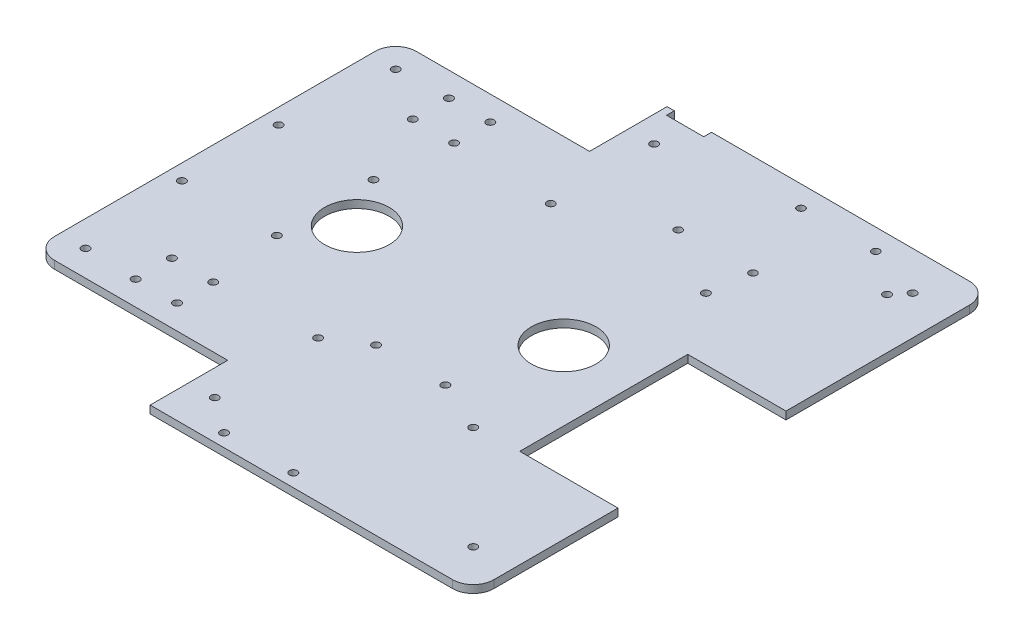
from build123d import *

# Parameters (mm, degrees)
SKETCH1_W                      = 200
SKETCH1_H                      = 200
BOSS_EXTRUDE1_DEPTH            = 3
CUT_EXTRUDE4_REACH             = 143.453
SKETCH4_R                      = 1.5
CUT_EXTRUDE5_REACH             = 143.453
SKETCH5_W                      = 75
SKETCH5_H                      = 30
CUT_EXTRUDE5_DIRECTION_2_DEPTH = 142.453172464
CUT_EXTRUDE6_REACH             = 143.453
SKETCH3_R                      = 1.5
FILLET1_R                      = 8
CUT_EXTRUDE7_REACH             = 143.453
SKETCH6_R                      = 1.5
CUT_EXTRUDE9_REACH             = 143.453
SKETCH11_W                     = 38
SKETCH11_H                     = 65
CUT_EXTRUDE10_REACH            = 143.453
SKETCH12_R                     = 12.5
CUT_EXTRUDE11_REACH            = 143.453
SKETCH14_R                     = 1.5
CUT_EXTRUDE12_REACH            = 143.453
SKETCH15_R                     = 1.5
CUT_EXTRUDE14_REACH            = 143.453
SKETCH17_R                     = 1.4605
CUT_EXTRUDE15_REACH            = 143.453
SKETCH18_R                     = 1.5
CUT_EXTRUDE17_REACH            = 143.453
SKETCH19_W                     = 14.4
SKETCH19_H                     = 3


with BuildPart() as part:
    # Sketch1 → Boss-Extrude1 (new body)
    with BuildSketch(Plane(origin=(0, 0, 0), x_dir=(1, 0, 0), z_dir=(0, 1, 0))):
        Rectangle(SKETCH1_W, SKETCH1_H)
    extrude(amount=BOSS_EXTRUDE1_DEPTH)

    # Sketch4 → Cut-Extrude4 (cut, up to next)
    with BuildSketch(Plane.XZ, mode=Mode.PRIVATE) as cut_extrude4_sk1:
        with Locations(Location((-15, 45, 0), (0, 0, 270))):
            Circle(SKETCH4_R)
    cut_extrude4_tool1 = extrude(cut_extrude4_sk1.sketch, amount=-CUT_EXTRUDE4_REACH, mode=Mode.PRIVATE) & part.part
    # Sketch4 → Cut-Extrude4 (cut, up to next)
    with BuildSketch(Plane.XZ, mode=Mode.PRIVATE) as cut_extrude4_sk2:
        with Locations(Location((45, 45, 0), (0, 0, 270))):
            Circle(SKETCH4_R)
    cut_extrude4_tool2 = extrude(cut_extrude4_sk2.sketch, amount=-CUT_EXTRUDE4_REACH, mode=Mode.PRIVATE) & part.part
    # Sketch4 → Cut-Extrude4 (cut, up to next)
    with BuildSketch(Plane.XZ, mode=Mode.PRIVATE) as cut_extrude4_sk3:
        with Locations(Location((45, -45, 0), (0, 0, 270))):
            Circle(SKETCH4_R)
    cut_extrude4_tool3 = extrude(cut_extrude4_sk3.sketch, amount=-CUT_EXTRUDE4_REACH, mode=Mode.PRIVATE) & part.part
    # Sketch4 → Cut-Extrude4 (cut, up to next)
    with BuildSketch(Plane.XZ, mode=Mode.PRIVATE) as cut_extrude4_sk4:
        with Locations(Location((-15, -45, 0), (0, 0, 270))):
            Circle(SKETCH4_R)
    cut_extrude4_tool4 = extrude(cut_extrude4_sk4.sketch, amount=-CUT_EXTRUDE4_REACH, mode=Mode.PRIVATE) & part.part
    add(cut_extrude4_tool1.solids().sort_by_distance((-15, 0, 45))[0], mode=Mode.SUBTRACT)
    add(cut_extrude4_tool2.solids().sort_by_distance((45, 0, 45))[0], mode=Mode.SUBTRACT)
    add(cut_extrude4_tool3.solids().sort_by_distance((45, 0, -45))[0], mode=Mode.SUBTRACT)
    add(cut_extrude4_tool4.solids().sort_by_distance((-15, 0, -45))[0], mode=Mode.SUBTRACT)

    # Sketch5 → Cut-Extrude5 (cut, up to next)
    with BuildSketch(Plane.XZ, mode=Mode.PRIVATE) as cut_extrude5_sk1:
        with Locations((-62.5, -85)):
            Rectangle(SKETCH5_W, SKETCH5_H)
    cut_extrude5_tool1 = extrude(cut_extrude5_sk1.sketch, amount=-CUT_EXTRUDE5_REACH, mode=Mode.PRIVATE) & part.part
    # Sketch5 → Cut-Extrude5 (cut, up to next)
    with BuildSketch(Plane.XZ, mode=Mode.PRIVATE) as cut_extrude5_sk2:
        with Locations((-62.5, 85)):
            Rectangle(SKETCH5_W, SKETCH5_H)
    cut_extrude5_tool2 = extrude(cut_extrude5_sk2.sketch, amount=-CUT_EXTRUDE5_REACH, mode=Mode.PRIVATE) & part.part
    add(cut_extrude5_tool1.solids().sort_by_distance((-62.5, 0, -85))[0], mode=Mode.SUBTRACT)
    add(cut_extrude5_tool2.solids().sort_by_distance((-62.5, 0, 85))[0], mode=Mode.SUBTRACT)

    # Sketch5 → Cut-Extrude5 direction 2 (cut)
    with BuildSketch(Plane.XZ):
        with Locations((-62.5, -85)):
            Rectangle(SKETCH5_W, SKETCH5_H)
        with Locations((-62.5, 85)):
            Rectangle(SKETCH5_W, SKETCH5_H)
    extrude(amount=CUT_EXTRUDE5_DIRECTION_2_DEPTH, mode=Mode.SUBTRACT)

    # Sketch3 → Cut-Extrude6 (cut, up to next)
    with BuildSketch(Plane.XZ, mode=Mode.PRIVATE) as cut_extrude6_sk1:
        with Locations(Location((-70, -60.6, 0), (0, 0, 270))):
            Circle(SKETCH3_R)
    cut_extrude6_tool1 = extrude(cut_extrude6_sk1.sketch, amount=-CUT_EXTRUDE6_REACH, mode=Mode.PRIVATE) & part.part
    # Sketch3 → Cut-Extrude6 (cut, up to next)
    with BuildSketch(Plane.XZ, mode=Mode.PRIVATE) as cut_extrude6_sk2:
        with Locations(Location((-70, -46.6, 0), (0, 0, 270))):
            Circle(SKETCH3_R)
    cut_extrude6_tool2 = extrude(cut_extrude6_sk2.sketch, amount=-CUT_EXTRUDE6_REACH, mode=Mode.PRIVATE) & part.part
    # Sketch3 → Cut-Extrude6 (cut, up to next)
    with BuildSketch(Plane.XZ, mode=Mode.PRIVATE) as cut_extrude6_sk3:
        with Locations(Location((-54, -46.6, 0), (0, 0, 270))):
            Circle(SKETCH3_R)
    cut_extrude6_tool3 = extrude(cut_extrude6_sk3.sketch, amount=-CUT_EXTRUDE6_REACH, mode=Mode.PRIVATE) & part.part
    # Sketch3 → Cut-Extrude6 (cut, up to next)
    with BuildSketch(Plane.XZ, mode=Mode.PRIVATE) as cut_extrude6_sk4:
        with Locations(Location((-54, -60.6, 0), (0, 0, 270))):
            Circle(SKETCH3_R)
    cut_extrude6_tool4 = extrude(cut_extrude6_sk4.sketch, amount=-CUT_EXTRUDE6_REACH, mode=Mode.PRIVATE) & part.part
    # Sketch3 → Cut-Extrude6 (cut, up to next)
    with BuildSketch(Plane.XZ, mode=Mode.PRIVATE) as cut_extrude6_sk5:
        with Locations(Location((-70, 60.6, 0), (0, 0, 270))):
            Circle(SKETCH3_R)
    cut_extrude6_tool5 = extrude(cut_extrude6_sk5.sketch, amount=-CUT_EXTRUDE6_REACH, mode=Mode.PRIVATE) & part.part
    # Sketch3 → Cut-Extrude6 (cut, up to next)
    with BuildSketch(Plane.XZ, mode=Mode.PRIVATE) as cut_extrude6_sk6:
        with Locations(Location((-54, 60.6, 0), (0, 0, 270))):
            Circle(SKETCH3_R)
    cut_extrude6_tool6 = extrude(cut_extrude6_sk6.sketch, amount=-CUT_EXTRUDE6_REACH, mode=Mode.PRIVATE) & part.part
    # Sketch3 → Cut-Extrude6 (cut, up to next)
    with BuildSketch(Plane.XZ, mode=Mode.PRIVATE) as cut_extrude6_sk7:
        with Locations(Location((-70, 46.6, 0), (0, 0, 270))):
            Circle(SKETCH3_R)
    cut_extrude6_tool7 = extrude(cut_extrude6_sk7.sketch, amount=-CUT_EXTRUDE6_REACH, mode=Mode.PRIVATE) & part.part
    # Sketch3 → Cut-Extrude6 (cut, up to next)
    with BuildSketch(Plane.XZ, mode=Mode.PRIVATE) as cut_extrude6_sk8:
        with Locations(Location((-54, 46.6, 0), (0, 0, 270))):
            Circle(SKETCH3_R)
    cut_extrude6_tool8 = extrude(cut_extrude6_sk8.sketch, amount=-CUT_EXTRUDE6_REACH, mode=Mode.PRIVATE) & part.part
    add(cut_extrude6_tool1.solids().sort_by_distance((-70, 0, -60.6))[0], mode=Mode.SUBTRACT)
    add(cut_extrude6_tool2.solids().sort_by_distance((-70, 0, -46.6))[0], mode=Mode.SUBTRACT)
    add(cut_extrude6_tool3.solids().sort_by_distance((-54, 0, -46.6))[0], mode=Mode.SUBTRACT)
    add(cut_extrude6_tool4.solids().sort_by_distance((-54, 0, -60.6))[0], mode=Mode.SUBTRACT)
    add(cut_extrude6_tool5.solids().sort_by_distance((-70, 0, 60.6))[0], mode=Mode.SUBTRACT)
    add(cut_extrude6_tool6.solids().sort_by_distance((-54, 0, 60.6))[0], mode=Mode.SUBTRACT)
    add(cut_extrude6_tool7.solids().sort_by_distance((-70, 0, 46.6))[0], mode=Mode.SUBTRACT)
    add(cut_extrude6_tool8.solids().sort_by_distance((-54, 0, 46.6))[0], mode=Mode.SUBTRACT)

    # Fillet1
    fillet1_edges = [part.edges().sort_by_distance(p)[0] for p in [
        (-100, 1.5, -70),
        (-100, 1.5, 70),
        (100, 1.5, 100),
        (100, 1.5, -100),
    ]]
    fillet(fillet1_edges, radius=FILLET1_R)

    # Sketch6 → Cut-Extrude7 (cut, up to next)
    with BuildSketch(Plane.XZ, mode=Mode.PRIVATE) as cut_extrude7_sk1:
        with Locations(Location((-90, 60, 0), (0, 0, 270))):
            Circle(SKETCH6_R)
    cut_extrude7_tool1 = extrude(cut_extrude7_sk1.sketch, amount=-CUT_EXTRUDE7_REACH, mode=Mode.PRIVATE) & part.part
    # Sketch6 → Cut-Extrude7 (cut, up to next)
    with BuildSketch(Plane.XZ, mode=Mode.PRIVATE) as cut_extrude7_sk2:
        with Locations(Location((-90, -60, 0), (0, 0, 270))):
            Circle(SKETCH6_R)
    cut_extrude7_tool2 = extrude(cut_extrude7_sk2.sketch, amount=-CUT_EXTRUDE7_REACH, mode=Mode.PRIVATE) & part.part
    # Sketch6 → Cut-Extrude7 (cut, up to next)
    with BuildSketch(Plane.XZ, mode=Mode.PRIVATE) as cut_extrude7_sk3:
        with Locations(Location((-15, -85, 0), (0, 0, 270))):
            Circle(SKETCH6_R)
    cut_extrude7_tool3 = extrude(cut_extrude7_sk3.sketch, amount=-CUT_EXTRUDE7_REACH, mode=Mode.PRIVATE) & part.part
    # Sketch6 → Cut-Extrude7 (cut, up to next)
    with BuildSketch(Plane.XZ, mode=Mode.PRIVATE) as cut_extrude7_sk4:
        with Locations(Location((85, -85, 0), (0, 0, 270))):
            Circle(SKETCH6_R)
    cut_extrude7_tool4 = extrude(cut_extrude7_sk4.sketch, amount=-CUT_EXTRUDE7_REACH, mode=Mode.PRIVATE) & part.part
    # Sketch6 → Cut-Extrude7 (cut, up to next)
    with BuildSketch(Plane.XZ, mode=Mode.PRIVATE) as cut_extrude7_sk5:
        with Locations(Location((85, 85, 0), (0, 0, 270))):
            Circle(SKETCH6_R)
    cut_extrude7_tool5 = extrude(cut_extrude7_sk5.sketch, amount=-CUT_EXTRUDE7_REACH, mode=Mode.PRIVATE) & part.part
    # Sketch6 → Cut-Extrude7 (cut, up to next)
    with BuildSketch(Plane.XZ, mode=Mode.PRIVATE) as cut_extrude7_sk6:
        with Locations(Location((-15, 85, 0), (0, 0, 270))):
            Circle(SKETCH6_R)
    cut_extrude7_tool6 = extrude(cut_extrude7_sk6.sketch, amount=-CUT_EXTRUDE7_REACH, mode=Mode.PRIVATE) & part.part
    add(cut_extrude7_tool1.solids().sort_by_distance((-90, 0, 60))[0], mode=Mode.SUBTRACT)
    add(cut_extrude7_tool2.solids().sort_by_distance((-90, 0, -60))[0], mode=Mode.SUBTRACT)
    add(cut_extrude7_tool3.solids().sort_by_distance((-15, 0, -85))[0], mode=Mode.SUBTRACT)
    add(cut_extrude7_tool4.solids().sort_by_distance((85, 0, -85))[0], mode=Mode.SUBTRACT)
    add(cut_extrude7_tool5.solids().sort_by_distance((85, 0, 85))[0], mode=Mode.SUBTRACT)
    add(cut_extrude7_tool6.solids().sort_by_distance((-15, 0, 85))[0], mode=Mode.SUBTRACT)

    # Sketch11 → Cut-Extrude9 (cut, up to next)
    with BuildSketch(Plane(origin=(0, 0, 0), x_dir=(1, 0, 0), z_dir=(0, 1, 0)), mode=Mode.PRIVATE) as cut_extrude9_sk1:
        with Locations((81, -11.5)):
            Rectangle(SKETCH11_W, SKETCH11_H)
    cut_extrude9_tool1 = extrude(cut_extrude9_sk1.sketch, amount=CUT_EXTRUDE9_REACH, mode=Mode.PRIVATE) & part.part
    add(cut_extrude9_tool1.solids().sort_by_distance((81, 0, 11.5))[0], mode=Mode.SUBTRACT)

    # Sketch12 → Cut-Extrude10 (cut, up to next)
    with BuildSketch(Plane(origin=(0, 0, 0), x_dir=(-1, 0, 0), z_dir=(0, -1, 0)), mode=Mode.PRIVATE) as cut_extrude10_sk1:
        with Locations(Location((-35, 0, 0), (0, 0, 90))):
            Circle(SKETCH12_R)
    cut_extrude10_tool1 = extrude(cut_extrude10_sk1.sketch, amount=-CUT_EXTRUDE10_REACH, mode=Mode.PRIVATE) & part.part
    # Sketch12 → Cut-Extrude10 (cut, up to next)
    with BuildSketch(Plane(origin=(0, 0, 0), x_dir=(-1, 0, 0), z_dir=(0, -1, 0)), mode=Mode.PRIVATE) as cut_extrude10_sk2:
        with Locations(Location((45, 0, 0), (0, 0, 90))):
            Circle(SKETCH12_R)
    cut_extrude10_tool2 = extrude(cut_extrude10_sk2.sketch, amount=-CUT_EXTRUDE10_REACH, mode=Mode.PRIVATE) & part.part
    add(cut_extrude10_tool1.solids().sort_by_distance((35, 0, 0))[0], mode=Mode.SUBTRACT)
    add(cut_extrude10_tool2.solids().sort_by_distance((-45, 0, 0))[0], mode=Mode.SUBTRACT)

    # Sketch14 → Cut-Extrude11 (cut, up to next)
    with BuildSketch(Plane(origin=(0, 0, 0), x_dir=(-1, 0, 0), z_dir=(0, -1, 0)), mode=Mode.PRIVATE) as cut_extrude11_sk1:
        with Locations(Location((94, 18.7, 0), (0, 0, 90))):
            Circle(SKETCH14_R)
    cut_extrude11_tool1 = extrude(cut_extrude11_sk1.sketch, amount=-CUT_EXTRUDE11_REACH, mode=Mode.PRIVATE) & part.part
    # Sketch14 → Cut-Extrude11 (cut, up to next)
    with BuildSketch(Plane(origin=(0, 0, 0), x_dir=(-1, 0, 0), z_dir=(0, -1, 0)), mode=Mode.PRIVATE) as cut_extrude11_sk2:
        with Locations(Location((94, -18.7, 0), (0, 0, 90))):
            Circle(SKETCH14_R)
    cut_extrude11_tool2 = extrude(cut_extrude11_sk2.sketch, amount=-CUT_EXTRUDE11_REACH, mode=Mode.PRIVATE) & part.part
    # Sketch14 → Cut-Extrude11 (cut, up to next)
    with BuildSketch(Plane(origin=(0, 0, 0), x_dir=(-1, 0, 0), z_dir=(0, -1, 0)), mode=Mode.PRIVATE) as cut_extrude11_sk3:
        with Locations(Location((57.3, -18.7, 0), (0, 0, 90))):
            Circle(SKETCH14_R)
    cut_extrude11_tool3 = extrude(cut_extrude11_sk3.sketch, amount=-CUT_EXTRUDE11_REACH, mode=Mode.PRIVATE) & part.part
    # Sketch14 → Cut-Extrude11 (cut, up to next)
    with BuildSketch(Plane(origin=(0, 0, 0), x_dir=(-1, 0, 0), z_dir=(0, -1, 0)), mode=Mode.PRIVATE) as cut_extrude11_sk4:
        with Locations(Location((57.3, 18.7, 0), (0, 0, 90))):
            Circle(SKETCH14_R)
    cut_extrude11_tool4 = extrude(cut_extrude11_sk4.sketch, amount=-CUT_EXTRUDE11_REACH, mode=Mode.PRIVATE) & part.part
    add(cut_extrude11_tool1.solids().sort_by_distance((-94, 0, -18.7))[0], mode=Mode.SUBTRACT)
    add(cut_extrude11_tool2.solids().sort_by_distance((-94, 0, 18.7))[0], mode=Mode.SUBTRACT)
    add(cut_extrude11_tool3.solids().sort_by_distance((-57.3, 0, 18.7))[0], mode=Mode.SUBTRACT)
    add(cut_extrude11_tool4.solids().sort_by_distance((-57.3, 0, -18.7))[0], mode=Mode.SUBTRACT)

    # Sketch15 → Cut-Extrude12 (cut, up to next)
    with BuildSketch(Plane(origin=(0, 0, 0), x_dir=(-1, 0, 0), z_dir=(0, -1, 0)), mode=Mode.PRIVATE) as cut_extrude12_sk1:
        with Locations(Location((1.4, -95, 0), (0, 0, 90))):
            Circle(SKETCH15_R)
    cut_extrude12_tool1 = extrude(cut_extrude12_sk1.sketch, amount=-CUT_EXTRUDE12_REACH, mode=Mode.PRIVATE) & part.part
    # Sketch15 → Cut-Extrude12 (cut, up to next)
    with BuildSketch(Plane(origin=(0, 0, 0), x_dir=(-1, 0, 0), z_dir=(0, -1, 0)), mode=Mode.PRIVATE) as cut_extrude12_sk2:
        with Locations(Location((-25.4, -95, 0), (0, 0, 90))):
            Circle(SKETCH15_R)
    cut_extrude12_tool2 = extrude(cut_extrude12_sk2.sketch, amount=-CUT_EXTRUDE12_REACH, mode=Mode.PRIVATE) & part.part
    # Sketch15 → Cut-Extrude12 (cut, up to next)
    with BuildSketch(Plane(origin=(0, 0, 0), x_dir=(-1, 0, 0), z_dir=(0, -1, 0)), mode=Mode.PRIVATE) as cut_extrude12_sk3:
        with Locations(Location((-25.4, -36.2, 0), (0, 0, 90))):
            Circle(SKETCH15_R)
    cut_extrude12_tool3 = extrude(cut_extrude12_sk3.sketch, amount=-CUT_EXTRUDE12_REACH, mode=Mode.PRIVATE) & part.part
    # Sketch15 → Cut-Extrude12 (cut, up to next)
    with BuildSketch(Plane(origin=(0, 0, 0), x_dir=(-1, 0, 0), z_dir=(0, -1, 0)), mode=Mode.PRIVATE) as cut_extrude12_sk4:
        with Locations(Location((1.4, -36.2, 0), (0, 0, 90))):
            Circle(SKETCH15_R)
    cut_extrude12_tool4 = extrude(cut_extrude12_sk4.sketch, amount=-CUT_EXTRUDE12_REACH, mode=Mode.PRIVATE) & part.part
    add(cut_extrude12_tool1.solids().sort_by_distance((-1.4, 0, 95))[0], mode=Mode.SUBTRACT)
    add(cut_extrude12_tool2.solids().sort_by_distance((25.4, 0, 95))[0], mode=Mode.SUBTRACT)
    add(cut_extrude12_tool3.solids().sort_by_distance((25.4, 0, 36.2))[0], mode=Mode.SUBTRACT)
    add(cut_extrude12_tool4.solids().sort_by_distance((-1.4, 0, 36.2))[0], mode=Mode.SUBTRACT)

    # Sketch17 → Cut-Extrude14 (cut, up to next)
    with BuildSketch(Plane(origin=(0, 3, 0), x_dir=(1, 0, 0), z_dir=(0, 1, 0)), mode=Mode.PRIVATE) as cut_extrude14_sk1:
        with Locations(Location((63.888834254, 91.851002341, 0), (0, 0, 270))):
            Circle(SKETCH17_R)
    cut_extrude14_tool1 = extrude(cut_extrude14_sk1.sketch, amount=-CUT_EXTRUDE14_REACH, mode=Mode.PRIVATE) & part.part
    # Sketch17 → Cut-Extrude14 (cut, up to next)
    with BuildSketch(Plane(origin=(0, 3, 0), x_dir=(1, 0, 0), z_dir=(0, 1, 0)), mode=Mode.PRIVATE) as cut_extrude14_sk2:
        with Locations(Location((47.366092037, 60.851172908, 0), (0, 0, 270))):
            Circle(SKETCH17_R)
    cut_extrude14_tool2 = extrude(cut_extrude14_sk2.sketch, amount=-CUT_EXTRUDE14_REACH, mode=Mode.PRIVATE) & part.part
    # Sketch17 → Cut-Extrude14 (cut, up to next)
    with BuildSketch(Plane(origin=(0, 3, 0), x_dir=(1, 0, 0), z_dir=(0, 1, 0)), mode=Mode.PRIVATE) as cut_extrude14_sk3:
        with Locations(Location((34.962819931, 91.851002341, 0), (0, 0, 270))):
            Circle(SKETCH17_R)
    cut_extrude14_tool3 = extrude(cut_extrude14_sk3.sketch, amount=-CUT_EXTRUDE14_REACH, mode=Mode.PRIVATE) & part.part
    # Sketch17 → Cut-Extrude14 (cut, up to next)
    with BuildSketch(Plane(origin=(0, 3, 0), x_dir=(1, 0, 0), z_dir=(0, 1, 0)), mode=Mode.PRIVATE) as cut_extrude14_sk4:
        with Locations(Location((18.440077714, 60.851172908, 0), (0, 0, 270))):
            Circle(SKETCH17_R)
    cut_extrude14_tool4 = extrude(cut_extrude14_sk4.sketch, amount=-CUT_EXTRUDE14_REACH, mode=Mode.PRIVATE) & part.part
    add(cut_extrude14_tool1.solids().sort_by_distance((63.888834, 3, -91.851002))[0], mode=Mode.SUBTRACT)
    add(cut_extrude14_tool2.solids().sort_by_distance((47.366092, 3, -60.851173))[0], mode=Mode.SUBTRACT)
    add(cut_extrude14_tool3.solids().sort_by_distance((34.96282, 3, -91.851002))[0], mode=Mode.SUBTRACT)
    add(cut_extrude14_tool4.solids().sort_by_distance((18.440078, 3, -60.851173))[0], mode=Mode.SUBTRACT)

    # Sketch18 → Cut-Extrude15 (cut, up to next)
    with BuildSketch(Plane(origin=(0, 3, 0), x_dir=(1, 0, 0), z_dir=(0, 1, 0)), mode=Mode.PRIVATE) as cut_extrude15_sk1:
        with Locations(Location((80.5, 79.613248654, 0), (0, 0, 270))):
            Circle(SKETCH18_R)
    cut_extrude15_tool1 = extrude(cut_extrude15_sk1.sketch, amount=-CUT_EXTRUDE15_REACH, mode=Mode.PRIVATE) & part.part
    add(cut_extrude15_tool1.solids().sort_by_distance((80.5, 3, -79.613249))[0], mode=Mode.SUBTRACT)

    # Sketch19 → Cut-Extrude17 (cut, up to next)
    with BuildSketch(Plane(origin=(0, 3, 0), x_dir=(1, 0, 0), z_dir=(0, 1, 0)), mode=Mode.PRIVATE) as cut_extrude17_sk1:
        with Locations((-15, 98.5)):
            Rectangle(SKETCH19_W, SKETCH19_H)
    cut_extrude17_tool1 = extrude(cut_extrude17_sk1.sketch, amount=-CUT_EXTRUDE17_REACH, mode=Mode.PRIVATE) & part.part
    add(cut_extrude17_tool1.solids().sort_by_distance((-15, 3, -98.5))[0], mode=Mode.SUBTRACT)


solid = part.part
